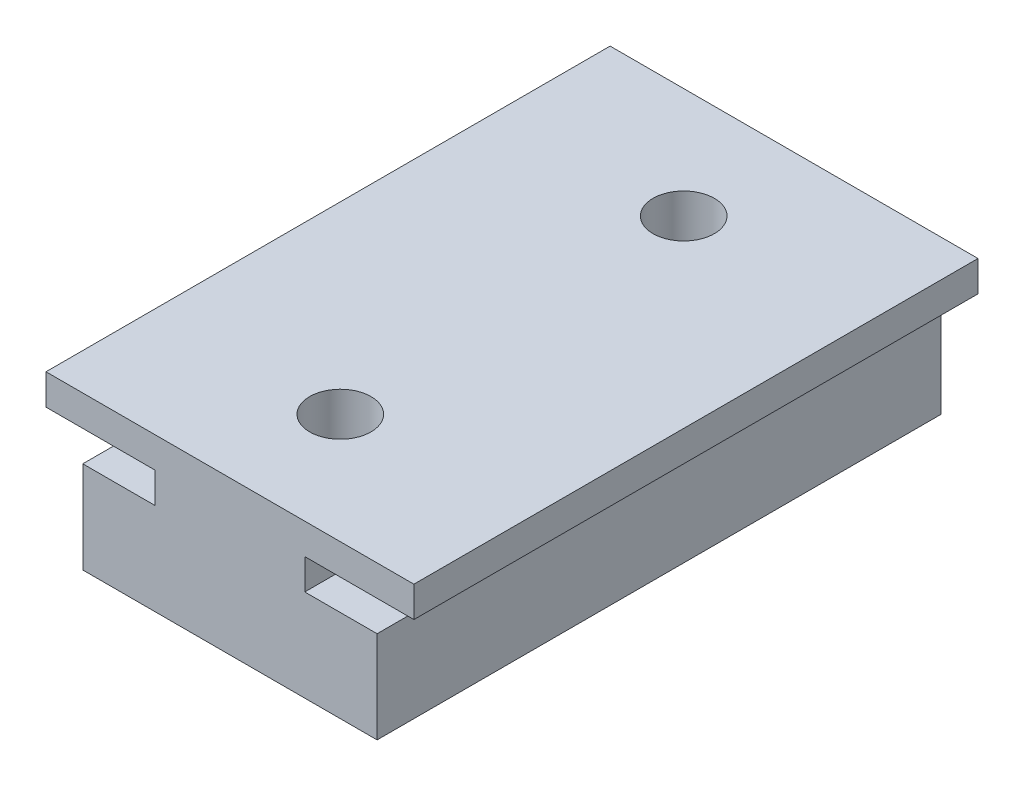
from build123d import *

# Parameters (mm, degrees)
BOSS_EXTRUDE1_DEPTH = 46
SKETCH2_R           = 2.5
CUT_EXTRUDE1_DEPTH  = 50.972492433


with BuildPart() as part:
    # Sketch1 → Boss-Extrude1 (new body)
    with BuildSketch(Plane.XY):
        Polygon((-15, 12.5), (15, 12.5), (15, 10), (6.1, 10), (6.1, 7.5), (12, 7.5), (12, 0), (-12, 0), (-12, 7.5), (-6.1, 7.5), (-6.1, 10), (-15, 10), align=None)
    extrude(amount=BOSS_EXTRUDE1_DEPTH)

    # Sketch2 → Cut-Extrude1 (cut, through all)
    with BuildSketch(Plane(origin=(0, 12.5, 0), x_dir=(1, 0, 0), z_dir=(0, 1, 0))):
        with Locations(Location((0, -9, 0), (0, 0, 270))):
            Circle(SKETCH2_R)
        with Locations(Location((0, -37, 0), (0, 0, 270))):
            Circle(SKETCH2_R)
    extrude(amount=-CUT_EXTRUDE1_DEPTH, mode=Mode.SUBTRACT)


solid = part.part
